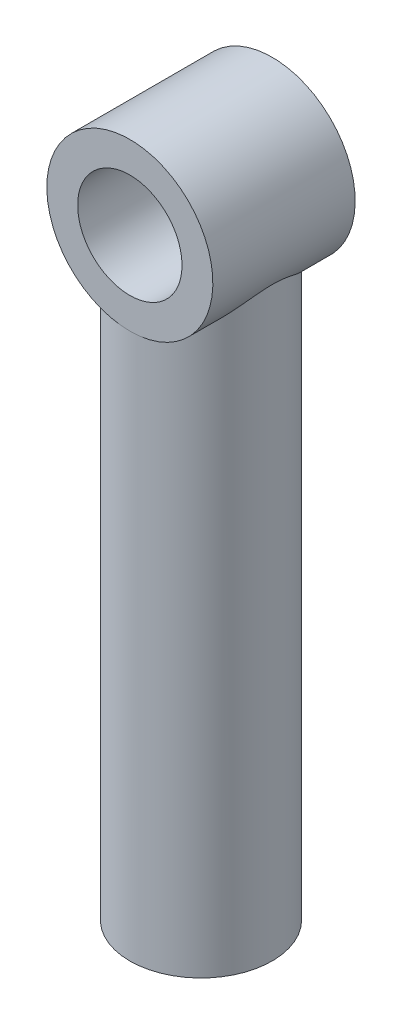
from build123d import *

# Parameters (mm, degrees)
SKETCH_1_R               = 15
EXTRUDE_1_DEPTH          = 65
SKETCH_2_R               = 17.5
EXTRUDE_4_DEPTH          = 15
CUT_EXTRUDE_1_DEPTH      = 89.069574902
CUT_EXTRUDE_1_DEPTH_BACK = 89.069574902
SKETCH_3_R               = 11


with BuildPart() as part:
    # 스케치1 → 보스-돌출1 (new, symmetric)
    with BuildSketch(Plane(origin=(0, 0, 0), x_dir=(1, 0, 0), z_dir=(0, 1, 0))):
        with Locations(Location((0, 0, 0), (0, 0, 270))):
            Circle(SKETCH_1_R)
    extrude(amount=EXTRUDE_1_DEPTH, both=True)

    # 스케치2 → 보스-돌출4 (add, symmetric)
    with BuildSketch(Plane.XY):
        with Locations((0, 67.5)):
            Circle(SKETCH_2_R)
    extrude(amount=EXTRUDE_4_DEPTH, both=True)

    # 스케치3 → 컷-돌출1 (cut, two sides: drawn at the far end of the back side and taken through both)
    with BuildSketch(Plane.XY.offset(-CUT_EXTRUDE_1_DEPTH_BACK)):
        with Locations((0, 67.5)):
            Circle(SKETCH_3_R)
    extrude(amount=CUT_EXTRUDE_1_DEPTH + CUT_EXTRUDE_1_DEPTH_BACK, mode=Mode.SUBTRACT)


solid = part.part
